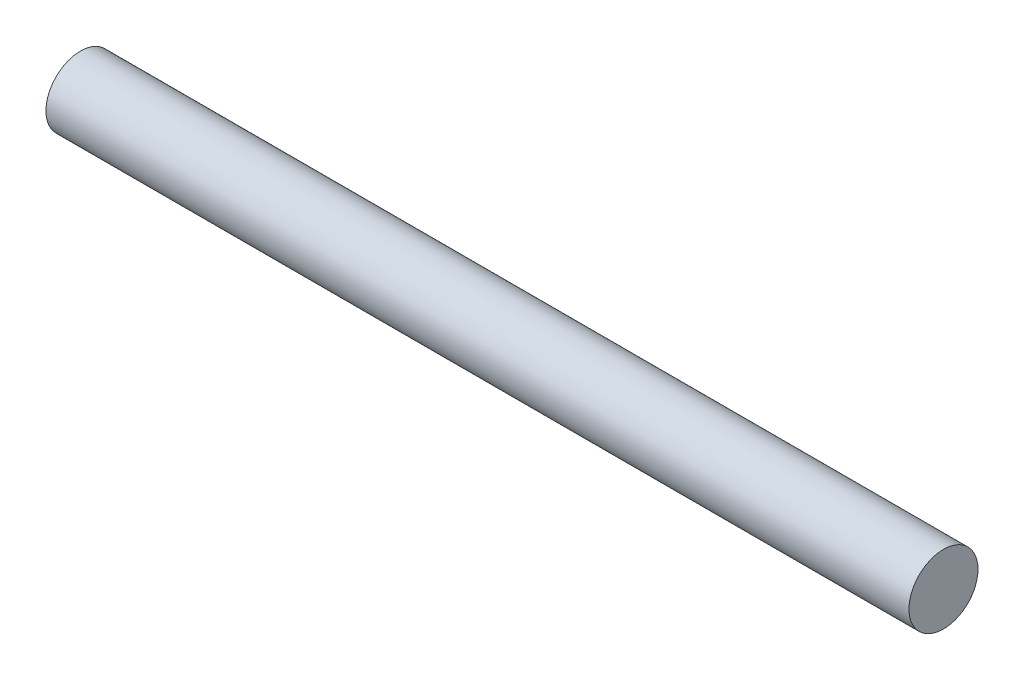
from build123d import *

# Parameters (mm, degrees)
SKETCH1_R           = 0.8
BOSS_EXTRUDE1_DEPTH = 20


with BuildPart() as part:
    # Sketch1 → Boss-Extrude1 (new body)
    with BuildSketch(Plane(origin=(0, 0, 0), x_dir=(0, 0, -1), z_dir=(1, 0, 0))):
        with Locations((-11.904988076, 2.365686275)):
            Circle(SKETCH1_R)
    extrude(amount=BOSS_EXTRUDE1_DEPTH)


solid = part.part
